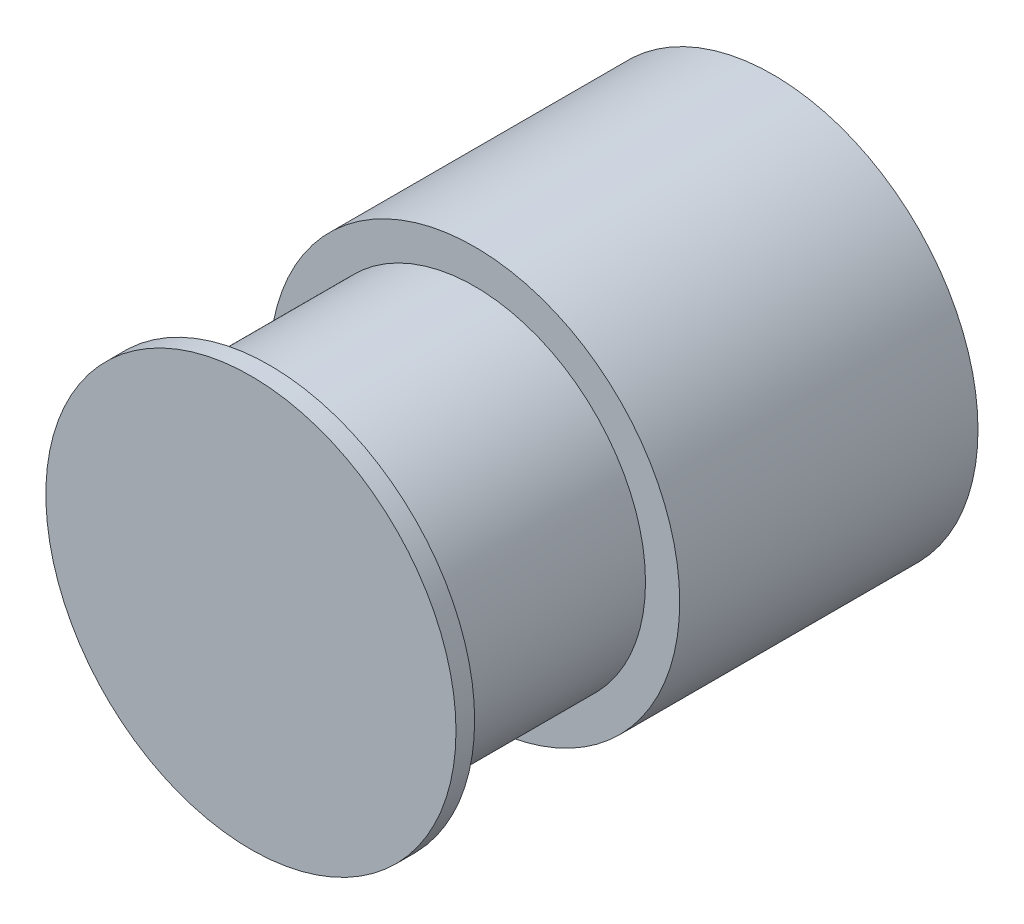
from build123d import *

# Parameters (mm, degrees)
SKETCH_1_R      = 11
SKETCH_1_R_2    = 2.5
EXTRUDE_1_DEPTH = 16
SKETCH_2_R      = 9.165
EXTRUDE_2_DEPTH = 11
SKETCH_3_R      = 11
EXTRUDE_3_DEPTH = 1


with BuildPart() as part:
    # 草图1 → 凸台-拉伸1 (new body)
    with BuildSketch(Plane.XY):
        Circle(SKETCH_1_R)
        Circle(SKETCH_1_R_2, mode=Mode.SUBTRACT)
    extrude(amount=EXTRUDE_1_DEPTH)

    # 草图2 → 凸台-拉伸2 (add)
    with BuildSketch(Plane.XY.offset(16)):
        Circle(SKETCH_2_R)
    extrude(amount=EXTRUDE_2_DEPTH)

    # 草图3 → 凸台-拉伸3 (add)
    with BuildSketch(Plane.XY.offset(27)):
        Circle(SKETCH_3_R)
    extrude(amount=EXTRUDE_3_DEPTH)


solid = part.part
